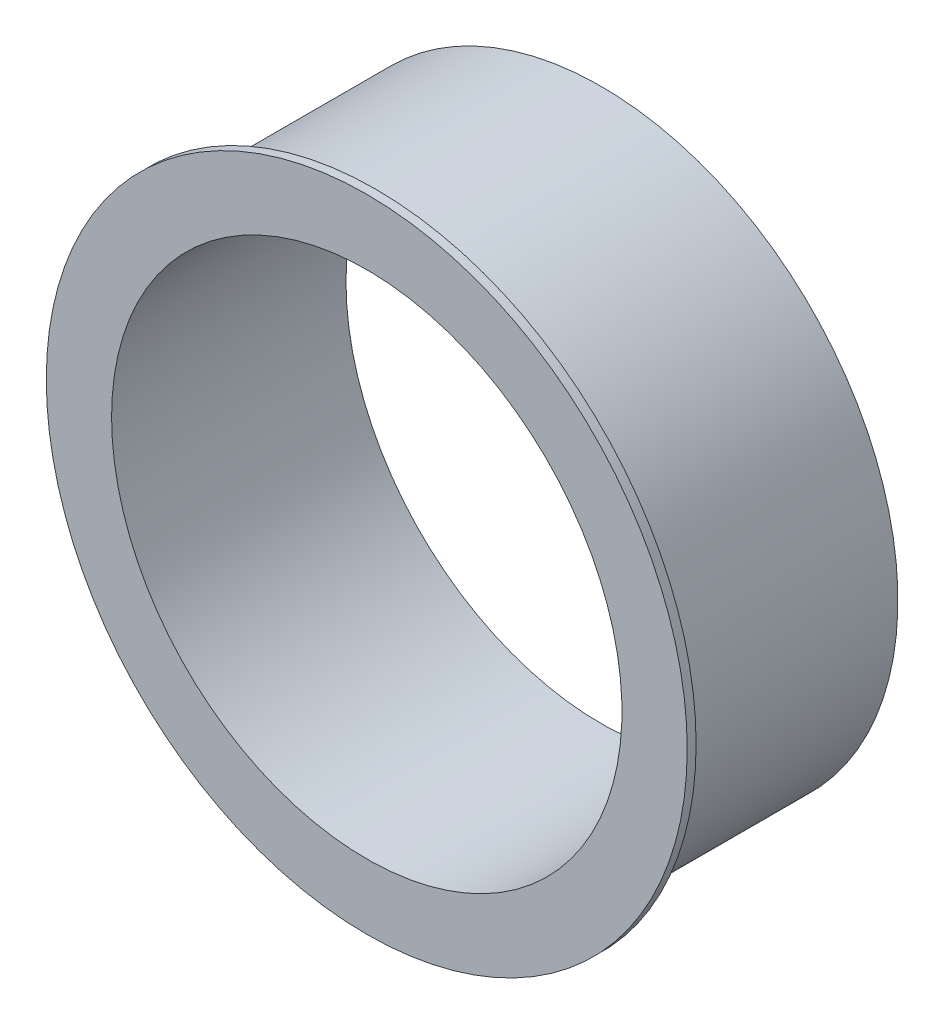
from build123d import *


with BuildPart() as part:
    # Sketch1 → Revolve1 (revolve)
    with BuildSketch(Plane(origin=(0, 0, 0), x_dir=(-1, 0, 0), z_dir=(0, 1, 0)), mode=Mode.PRIVATE) as revolve1_sk:
        Polygon((-43, -150), (-50, -150), (-50, -112), (-54, -112), (-54, -110.5), (-43, -110.5), align=None)
    revolve(revolve1_sk.sketch.rotate(Axis((0, 0, -500), (0, 0, 1)), 180), axis=Axis((0, 0, -500), (0, 0, 1)))


solid = part.part
